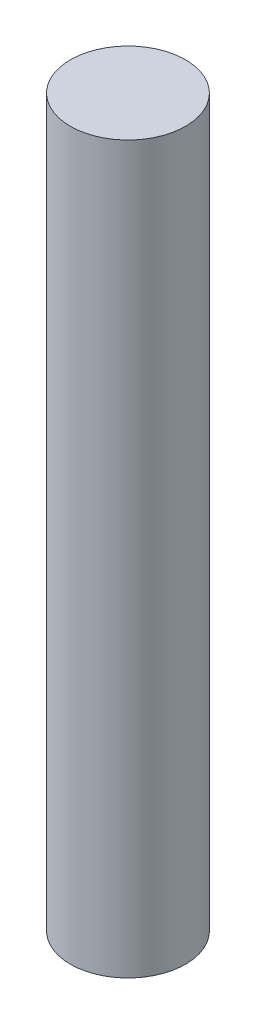
from build123d import *

# Parameters (mm, degrees)
SKETCH1_R           = 4.7625
BOSS_EXTRUDE1_DEPTH = 60


with BuildPart() as part:
    # Sketch1 → Boss-Extrude1 (new body)
    with BuildSketch(Plane(origin=(0, 0, 0), x_dir=(1, 0, 0), z_dir=(0, 1, 0))):
        with Locations(Location((0, 0, 0), (0, 0, 270))):
            Circle(SKETCH1_R)
    extrude(amount=BOSS_EXTRUDE1_DEPTH)


solid = part.part
